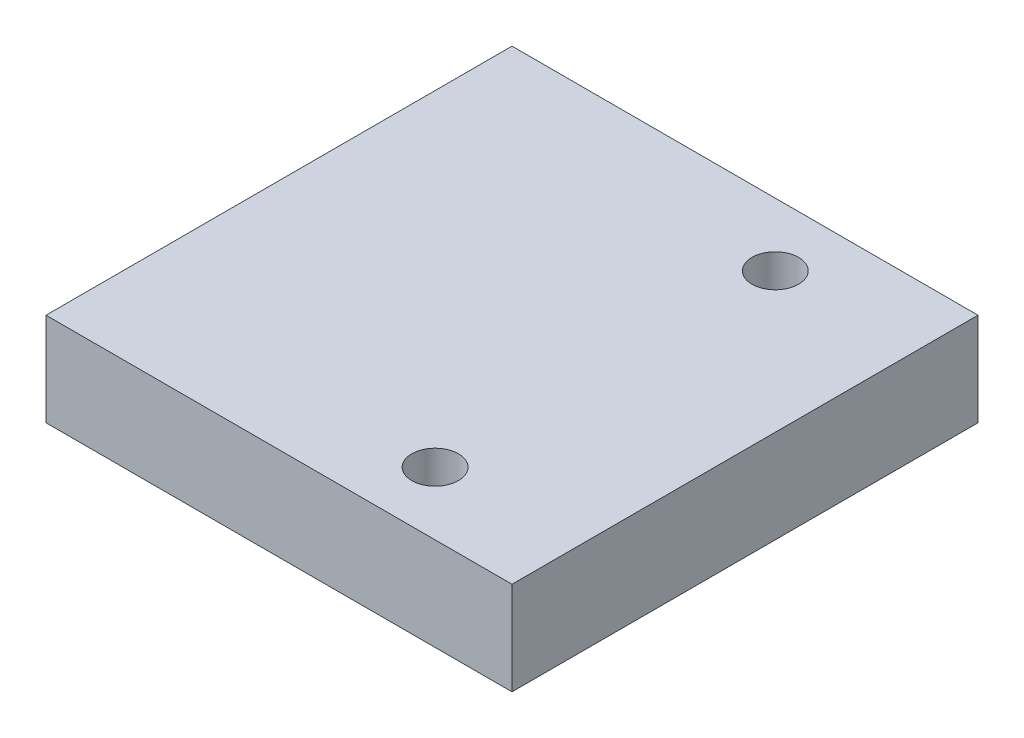
from build123d import *

# Parameters (mm, degrees)
ESBO_O2_W                = 50
ESBO_O2_H                = 50
RESSALTO_EXTRUS_O2_DEPTH = 10
ESBO_O5_R                = 2.5
CORTE_EXTRUS_O5_DEPTH    = 37.742346142


with BuildPart() as part:
    # Esboço2 → Ressalto-extrusão2 (new body)
    with BuildSketch(Plane(origin=(0, 0, 0), x_dir=(1, 0, 0), z_dir=(0, 1, 0))):
        Rectangle(ESBO_O2_W, ESBO_O2_H)
    extrude(amount=RESSALTO_EXTRUS_O2_DEPTH)

    # Esboço5 → Corte-extrusão5 (cut, through all)
    with BuildSketch(Plane(origin=(0, 10, 0), x_dir=(1, 0, 0), z_dir=(0, 1, 0))):
        with Locations(Location((10, 18.25, 0), (0, 0, 270))):
            Circle(ESBO_O5_R)
        with Locations(Location((10, -18.25, 0), (0, 0, 270))):
            Circle(ESBO_O5_R)
    extrude(amount=-CORTE_EXTRUS_O5_DEPTH, mode=Mode.SUBTRACT)


solid = part.part
